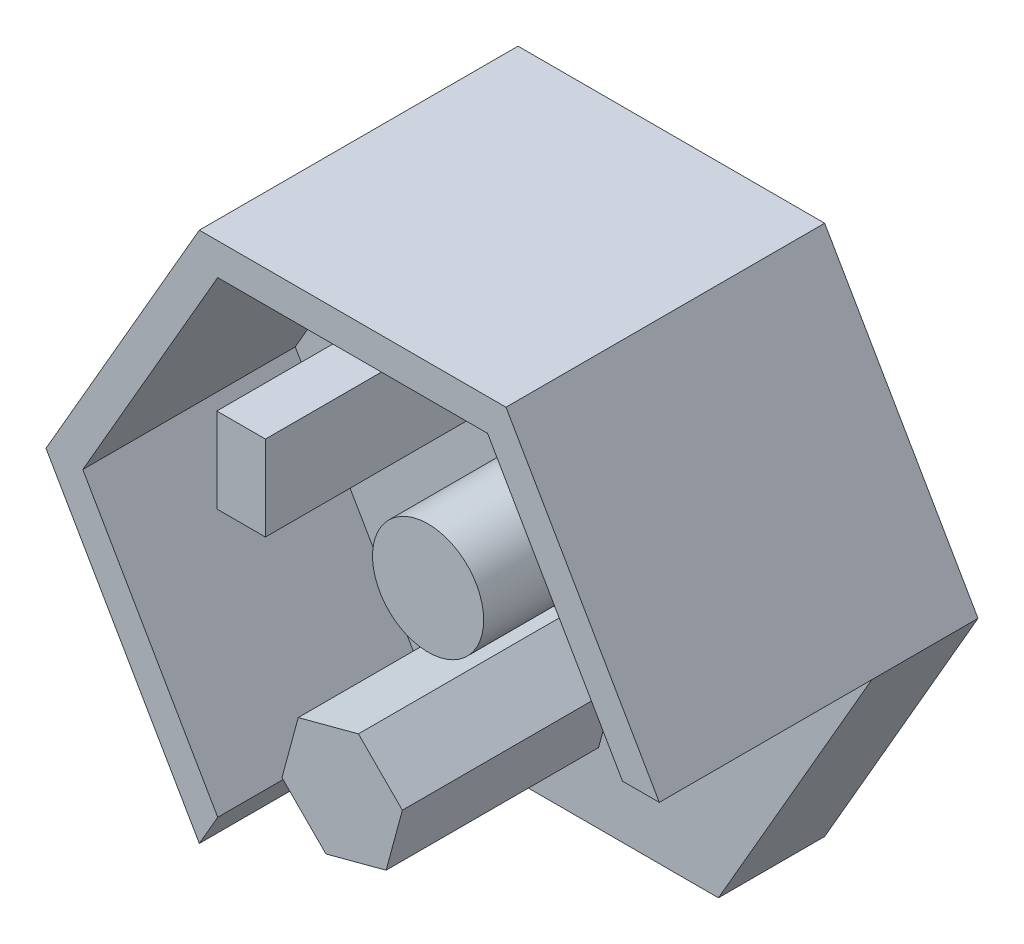
from build123d import *

# Parameters (mm, degrees)
BOSS_EXTRUDE1_DEPTH = 300
CUT_EXTRUDE1_DEPTH  = 200
CUT_EXTRUDE2_DEPTH  = 200
SKETCH4_R           = 52.323508973
SKETCH4_W           = 45.776374161
SKETCH4_H           = 79.884183104
BOSS_EXTRUDE2_DEPTH = 200
BOSS_EXTRUDE3_DEPTH = 200


with BuildPart() as part:
    # Sketch1 → Boss-Extrude1 (new body)
    with BuildSketch(Plane.XY):
        Polygon((144.337567297, -250), (288.675134595, 0), (144.337567297, 250), (-144.337567297, 250), (-288.675134595, 0), (-144.337567297, -250), align=None)
    extrude(amount=BOSS_EXTRUDE1_DEPTH)

    # Sketch2 → Cut-Extrude1 (cut)
    with BuildSketch(Plane.XY.offset(300)):
        Polygon((254.034118443, 0), (127.017059222, 220), (-127.017059222, 220), (-254.034118443, 0), (-127.017059222, -220), (127.017059222, -220), align=None)
    extrude(amount=-CUT_EXTRUDE1_DEPTH, mode=Mode.SUBTRACT)

    # Sketch3 → Cut-Extrude2 (cut)
    with BuildSketch(Plane.XY.offset(300)):
        Polygon((-127.017059222, -220), (-144.337567297, -250), (-253.098126512, -358.157726196), (520.522562071, -384.900169752), (552.995529246, 34.383141715), (288.675134595, 0), (254.034118443, 0), align=None)
    extrude(amount=-CUT_EXTRUDE2_DEPTH, mode=Mode.SUBTRACT)

    # Sketch4 → Boss-Extrude2 (add)
    with BuildSketch(Plane.XY.offset(100)):
        with Locations((71.000041779, 65.908432745)):
            Circle(SKETCH4_R)
        with Locations((-104.985312432, 70.865886515)):
            Rectangle(SKETCH4_W, SKETCH4_H)
    extrude(amount=BOSS_EXTRUDE2_DEPTH)

    # Sketch5 → Boss-Extrude3 (add)
    with BuildSketch(Plane.XY.offset(100)):
        Polygon((46.793412905, -127.30955218), (5.420185833, -85.764472901), (-51.245521762, -100.822198942), (-66.538002284, -157.425004263), (-25.164775212, -198.970083543), (31.500932383, -183.912357501), align=None)
    extrude(amount=BOSS_EXTRUDE3_DEPTH)


solid = part.part
